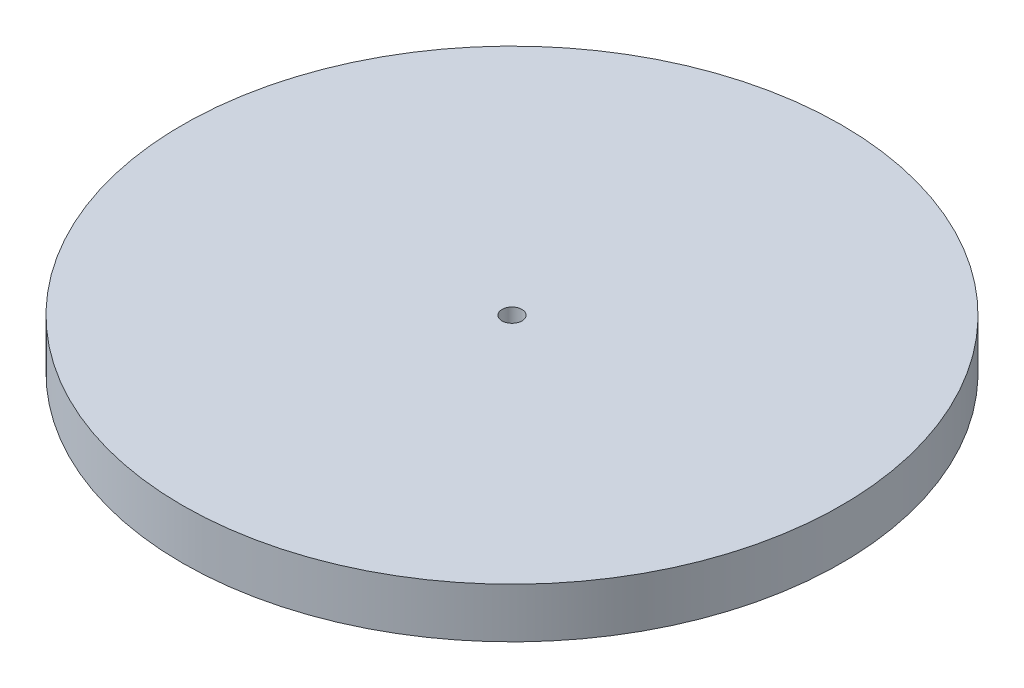
from build123d import *

# Parameters (mm, degrees)
SKETCH1_R           = 66
BOSS_EXTRUDE1_DEPTH = 10
SKETCH2_R           = 2
CUT_EXTRUDE1_DEPTH  = 10


with BuildPart() as part:
    # Sketch1 → Boss-Extrude1 (new body)
    with BuildSketch(Plane(origin=(0, 0, 0), x_dir=(1, 0, 0), z_dir=(0, 1, 0))):
        with Locations(Location((0, 0, 0), (0, 0, 270))):
            Circle(SKETCH1_R)
    extrude(amount=BOSS_EXTRUDE1_DEPTH)

    # Sketch2 → Cut-Extrude1 (cut)
    with BuildSketch(Plane(origin=(0, 10, 0), x_dir=(1, 0, 0), z_dir=(0, 1, 0))):
        with Locations(Location((0, 0, 0), (0, 0, 270))):
            Circle(SKETCH2_R)
    extrude(amount=-CUT_EXTRUDE1_DEPTH, mode=Mode.SUBTRACT)


solid = part.part
